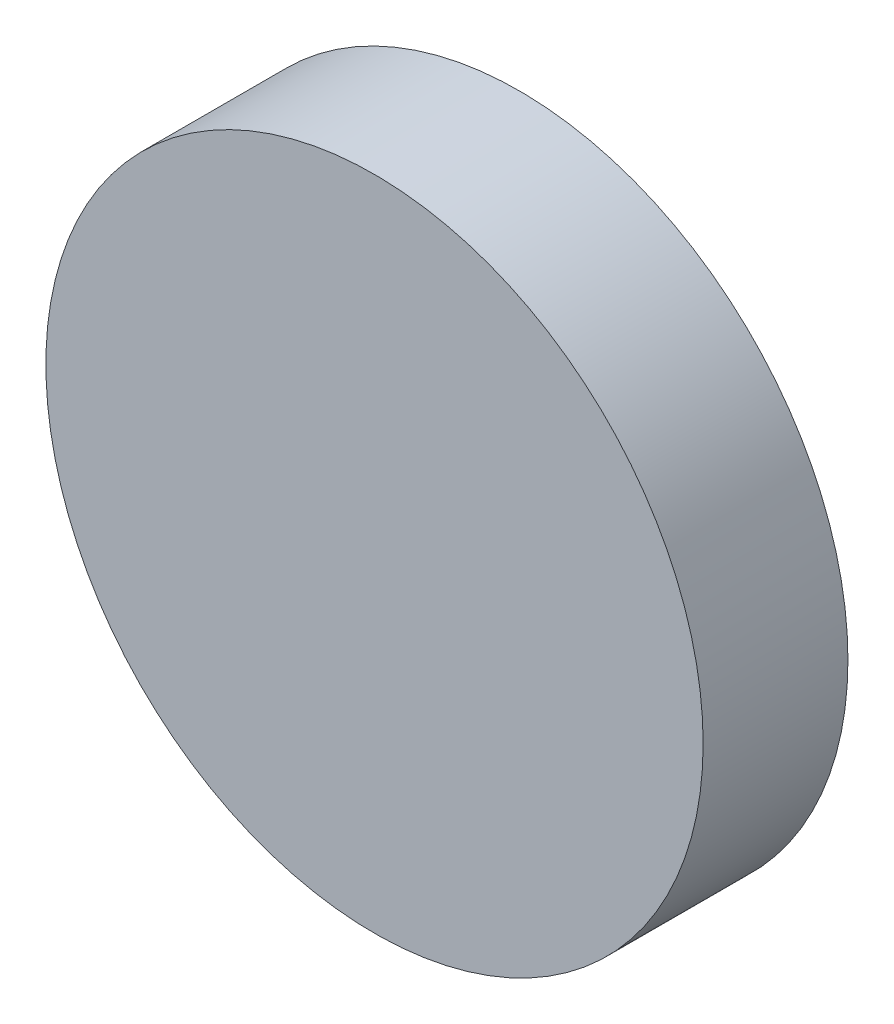
from build123d import *

# Parameters (mm, degrees)
SKETCH1_R           = 22.697049008
BOSS_EXTRUDE1_DEPTH = 10


with BuildPart() as part:
    # Sketch1 → Boss-Extrude1 (new body)
    with BuildSketch(Plane.XY):
        Circle(SKETCH1_R)
    extrude(amount=BOSS_EXTRUDE1_DEPTH)


solid = part.part
